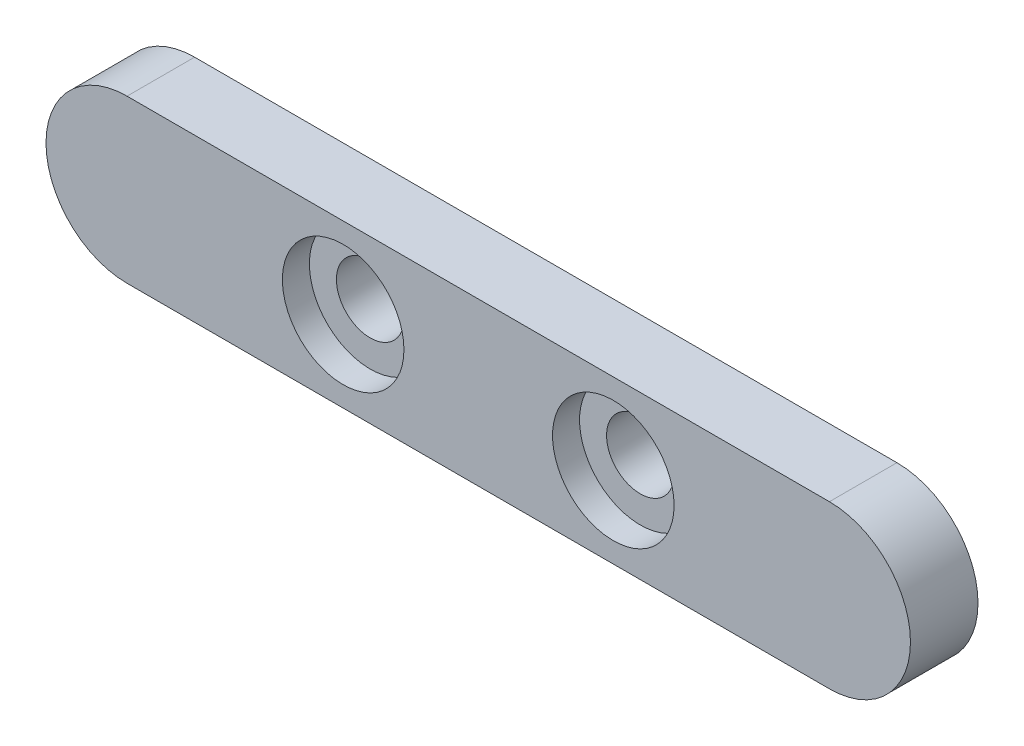
from build123d import *

# Parameters (mm, degrees)
SKETCH_1_R          = 1.25
EXTRUDE_1_DEPTH     = 2.5
SKETCH_2_R          = 2.25
CUT_EXTRUDE_1_DEPTH = 1
SCALE_1_SCALE       = 0.6


with BuildPart() as part:
    # 草图1 → 凸台-拉伸1 (new body)
    with BuildSketch(Plane.XY):
        with BuildLine():
            Line((-13, 3), (13, 3))
            ThreePointArc((13, 3), (16, 0), (13, -3))
            Line((13, -3), (-13, -3))
            ThreePointArc((-13, -3), (-16, 0), (-13, 3))
        make_face()
        with Locations((5, 0)):
            Circle(SKETCH_1_R, mode=Mode.SUBTRACT)
        with Locations((-5, 0)):
            Circle(SKETCH_1_R, mode=Mode.SUBTRACT)
    extrude(amount=EXTRUDE_1_DEPTH)

    # 草图2 → 切除-拉伸1 (cut)
    with BuildSketch(Plane.XY.offset(2.5)):
        with Locations((-5, 0)):
            Circle(SKETCH_2_R)
        with Locations((5, 0)):
            Circle(SKETCH_2_R)
    extrude(amount=-CUT_EXTRUDE_1_DEPTH, mode=Mode.SUBTRACT)


with BuildPart() as part_1:
    # 缩放比例1: scaled about (0, 0, 0)
    add(part.part.scale(SCALE_1_SCALE))


solid = part_1.part
